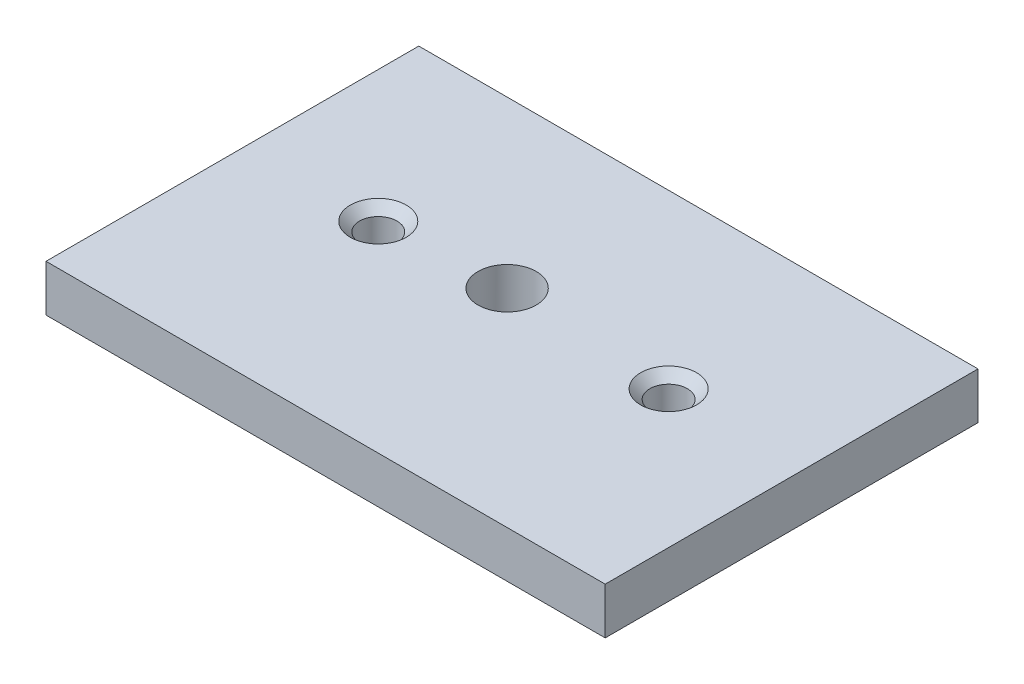
from build123d import *

# Parameters (mm, degrees)
SKETCH1_W                         = 76.2
SKETCH1_H                         = 50.8
BOSS_EXTRUDE1_DEPTH               = 6.35
F_1_4_20_TAPPED_HOLE1_D           = 5.1054
F_1_4_20_TAPPED_HOLE1_CSINK_D     = 7.62
F_1_4_20_TAPPED_HOLE1_CSINK_ANGLE = 90
F_3_8_16_TAPPED_HOLE1_D           = 7.9375


with BuildPart() as part:
    # Sketch1 → Boss-Extrude1 (new body)
    with BuildSketch(Plane(origin=(0, 0, 0), x_dir=(1, 0, 0), z_dir=(0, 1, 0))):
        with Locations((38.1, 25.4)):
            Rectangle(SKETCH1_W, SKETCH1_H)
    extrude(amount=BOSS_EXTRUDE1_DEPTH)

    # 1/4-20 Tapped Hole1 (through all)
    with Locations(Plane(origin=(0, 6.35, 0), x_dir=(1, 0, 0), z_dir=(0, 1, 0))):
        with Locations((17.905473556, 27.372280114), (57.470157442, 27.372280114)):
            CounterSinkHole(F_1_4_20_TAPPED_HOLE1_D / 2, F_1_4_20_TAPPED_HOLE1_CSINK_D / 2, counter_sink_angle=F_1_4_20_TAPPED_HOLE1_CSINK_ANGLE)

    # 3/8-16 Tapped Hole1 (through all)
    with Locations(Plane(origin=(0, 6.35, 0), x_dir=(1, 0, 0), z_dir=(0, 1, 0))):
        with Locations((34.599788687, 28.23429671)):
            Hole(F_3_8_16_TAPPED_HOLE1_D / 2)


solid = part.part
